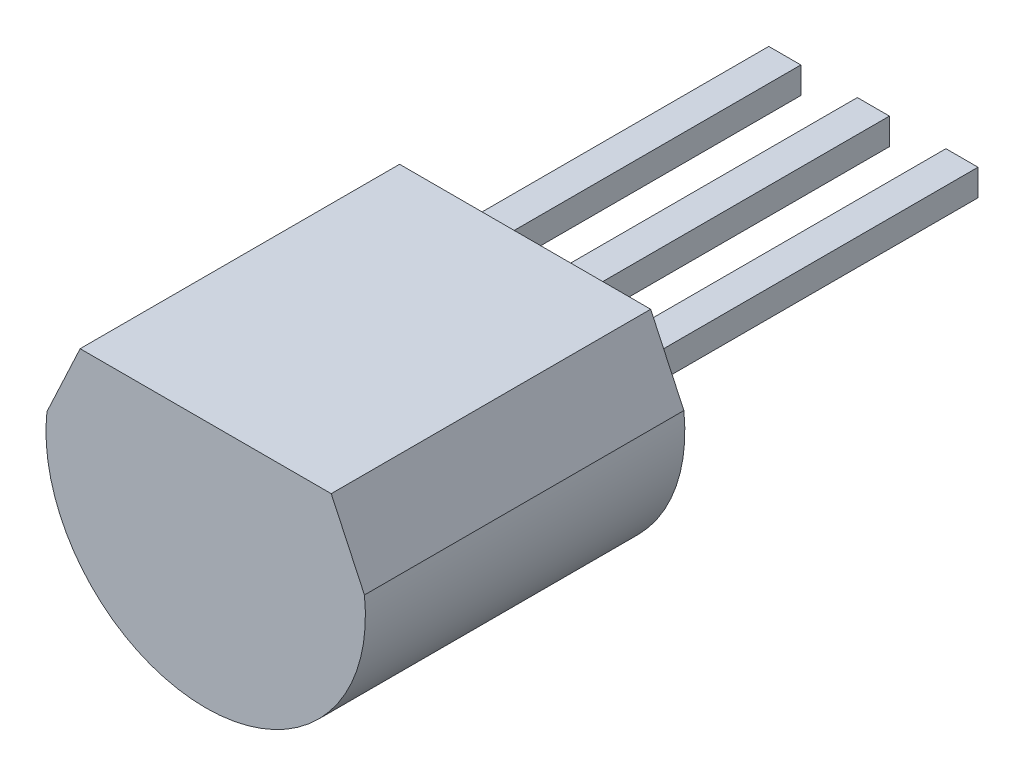
from build123d import *

# Parameters (mm, degrees)
EXTRUDE_1_DEPTH     = 4.58
SKETCH_2_W          = 0.46
SKETCH_2_H          = 0.38
EXTRUDE_2_DEPTH     = 5
SKETCH_3_R          = 0.6
CUT_EXTRUDE_1_DEPTH = 0.2


with BuildPart() as part:
    # 草图1 → 凸台-拉伸1 (new body)
    with BuildSketch(Plane.XY):
        with BuildLine():
            Line((-1.8, 1.27), (-2.276312808, 0.25))
            ThreePointArc((-2.276312808, 0.25), (0, -2.29), (2.276312808, 0.25))
            Line((2.276312808, 0.25), (1.8, 1.27))
            Line((1.8, 1.27), (-1.8, 1.27))
        make_face()
    extrude(amount=EXTRUDE_1_DEPTH)

    # 草图2 → 凸台-拉伸2 (add)
    with BuildSketch(Plane(origin=(0, 0, 0), x_dir=(-1, 0, 0), z_dir=(0, 0, -1))):
        with Locations((0.006718678, 0.19)):
            Rectangle(SKETCH_2_W, SKETCH_2_H)
        with Locations((1.276718678, 0.19)):
            Rectangle(SKETCH_2_W, SKETCH_2_H)
        with Locations((-1.263281322, 0.19)):
            Rectangle(SKETCH_2_W, SKETCH_2_H)
    extrude(amount=EXTRUDE_2_DEPTH)

    # 草图3 → 切除-拉伸1 (cut)
    with BuildSketch(Plane(origin=(0, -2.29, 0), x_dir=(-1, 0, 0), z_dir=(0, 1, 0))):
        with Locations((0, 2.220906824)):
            Circle(SKETCH_3_R)
    extrude(amount=CUT_EXTRUDE_1_DEPTH, mode=Mode.SUBTRACT)


solid = part.part
